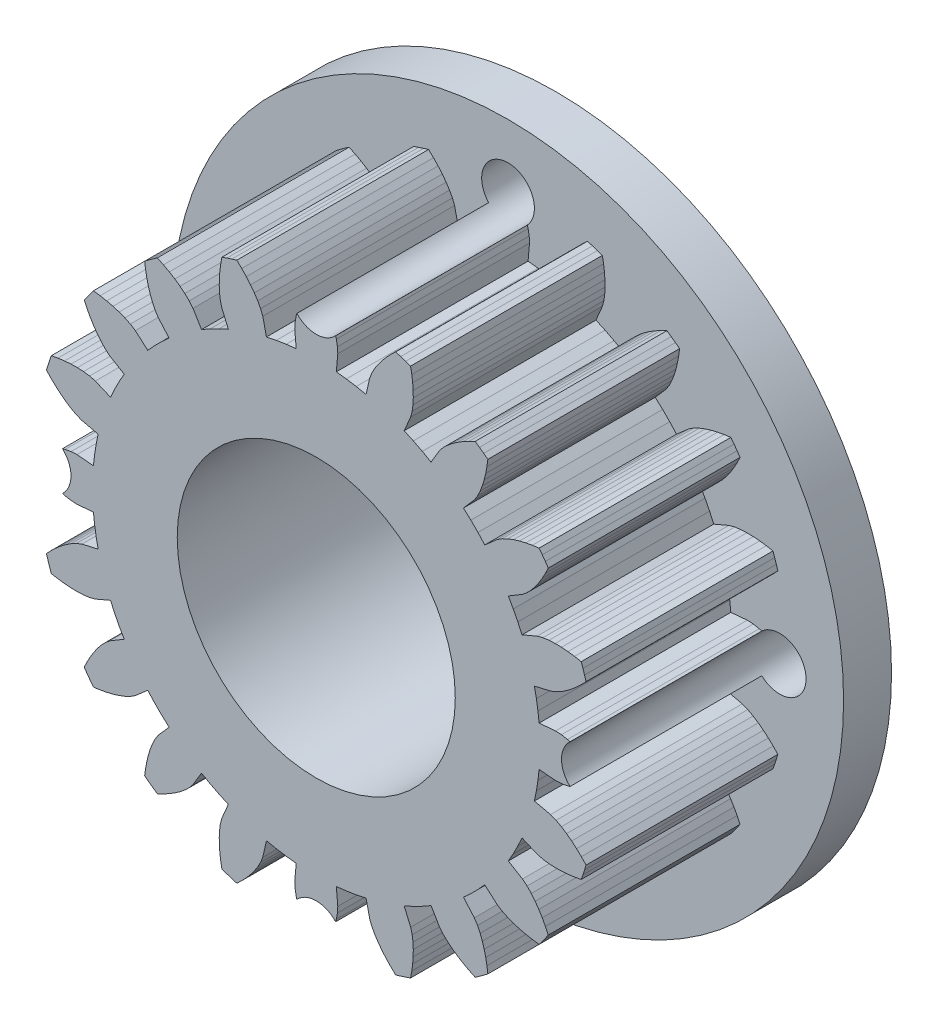
from build123d import *

# Parameters (mm, degrees)
SUN_TEETH_START     = 35
SKETCH_1_R          = 8.7
SUN_TEETH_DEPTH     = 12
SUN_FLANGE_START    = 32
SKETCH_2_R          = 21
SKETCH_2_R_2        = 8.7
SUN_FLANGE_DEPTH    = 3
SKETCH_3_R          = 1.65
THROUGH_HOLES_DEPTH = 100


with BuildPart() as part:
    # Эскиз1 → Sun_teeth (new body)
    with BuildSketch(Plane.XY.offset(SUN_TEETH_START)):
        Polygon((13.943722398, -1.25403576), (14.974643479, -1.346752171), (15.344385951, -1.325135863), (15.717782087, -1.256380008), (16.092947328, -1.1548734), (16.468861788, -1.025340024), (16.844697286, -0.870328211), (17.21970613, -0.691453831), (17.59318209, -0.489840726), (17.599242411, -0.163298986), (17.599242411, 0.163298986), (17.59318209, 0.489840726), (17.21970613, 0.691453831), (16.844697286, 0.870328211), (16.468861788, 1.025340024), (16.092947328, 1.1548734), (15.717782087, 1.256380008), (15.344385951, 1.325135863), (14.974643479, 1.346752171), (13.943722398, 1.25403576), (13.873337748, 1.878962405), (13.774959583, 2.500097694), (13.648786409, 3.116188305), (14.657901568, 3.346581891), (15.002867749, 3.48139693), (15.336741849, 3.662173385), (15.66217793, 3.874644342), (15.979665812, 4.11400186), (16.289205327, 4.37756641), (16.590584708, 4.663570161), (16.883479578, 4.970726036), (16.788336339, 5.283158428), (16.687412015, 5.593771558), (16.58074136, 5.902458466), (16.163242739, 5.978793504), (15.751312911, 6.033029043), (15.345970827, 6.064314481), (14.948426916, 6.071344086), (14.560256302, 6.051950172), (14.183888746, 6.001955124), (13.825562951, 5.908256748), (12.873749687, 5.501506067), (12.613696953, 6.074096572), (12.328192398, 6.634430811), (12.01781211, 7.181378146), (12.906342124, 7.712329201), (13.19276432, 7.947146335), (13.454434462, 8.222247732), (13.698285431, 8.524884899), (13.926268809, 8.850636577), (14.139212457, 9.196954331), (14.337461262, 9.562091412), (14.521104451, 9.944723502), (14.334070934, 10.212463486), (14.142101463, 10.476686796), (13.945262141, 10.737302446), (13.524608533, 10.680887212), (13.116080283, 10.605174957), (12.72090932, 10.509671585), (12.340650326, 10.393509312), (11.977471182, 10.255113287), (11.634973685, 10.0912612), (11.323139994, 9.891419989), (10.543604659, 9.210450629), (10.119339616, 9.674655846), (9.674655846, 10.119339616), (9.210450629, 10.543604659), (9.891419989, 11.323139994), (10.0912612, 11.634973685), (10.255113287, 11.977471182), (10.393509312, 12.340650326), (10.509671585, 12.72090932), (10.605174957, 13.116080283), (10.680887212, 13.524608533), (10.737302446, 13.945262141), (10.476686796, 14.142101463), (10.212463486, 14.334070934), (9.944723502, 14.521104451), (9.562091412, 14.337461262), (9.196954331, 14.139212457), (8.850636577, 13.926268809), (8.524884899, 13.698285431), (8.222247732, 13.454434462), (7.947146335, 13.19276432), (7.712329201, 12.906342124), (7.181378146, 12.01781211), (6.634430811, 12.328192398), (6.074096572, 12.613696953), (5.501506067, 12.873749687), (5.908256748, 13.825562951), (6.001955124, 14.183888746), (6.051950172, 14.560256302), (6.071344086, 14.948426916), (6.064314481, 15.345970827), (6.033029043, 15.751312911), (5.978793504, 16.163242739), (5.902458466, 16.58074136), (5.593771558, 16.687412015), (5.283158428, 16.788336339), (4.970726036, 16.883479578), (4.663570161, 16.590584708), (4.37756641, 16.289205327), (4.11400186, 15.979665812), (3.874644342, 15.66217793), (3.662173385, 15.336741849), (3.48139693, 15.002867749), (3.346581891, 14.657901568), (3.116188305, 13.648786409), (2.500097694, 13.774959583), (1.878962405, 13.873337748), (1.25403576, 13.943722398), (1.346752171, 14.974643479), (1.325135863, 15.344385951), (1.256380008, 15.717782087), (1.1548734, 16.092947328), (1.025340024, 16.468861788), (0.870328211, 16.844697286), (0.691453831, 17.21970613), (0.489840726, 17.59318209), (0.163298986, 17.599242411), (-0.163298986, 17.599242411), (-0.489840726, 17.59318209), (-0.691453831, 17.21970613), (-0.870328211, 16.844697286), (-1.025340024, 16.468861788), (-1.1548734, 16.092947328), (-1.256380008, 15.717782087), (-1.325135863, 15.344385951), (-1.346752171, 14.974643479), (-1.25403576, 13.943722398), (-1.878962405, 13.873337748), (-2.500097694, 13.774959583), (-3.116188305, 13.648786409), (-3.346581891, 14.657901568), (-3.48139693, 15.002867749), (-3.662173385, 15.336741849), (-3.874644342, 15.66217793), (-4.11400186, 15.979665812), (-4.37756641, 16.289205327), (-4.663570161, 16.590584708), (-4.970726036, 16.883479578), (-5.283158428, 16.788336339), (-5.593771558, 16.687412015), (-5.902458466, 16.58074136), (-5.978793504, 16.163242739), (-6.033029043, 15.751312911), (-6.064314481, 15.345970827), (-6.071344086, 14.948426916), (-6.051950172, 14.560256302), (-6.001955124, 14.183888746), (-5.908256748, 13.825562951), (-5.501506067, 12.873749687), (-6.074096572, 12.613696953), (-6.634430811, 12.328192398), (-7.181378146, 12.01781211), (-7.712329201, 12.906342124), (-7.947146335, 13.19276432), (-8.222247732, 13.454434462), (-8.524884899, 13.698285431), (-8.850636577, 13.926268809), (-9.196954331, 14.139212457), (-9.562091412, 14.337461262), (-9.944723502, 14.521104451), (-10.212463486, 14.334070934), (-10.476686796, 14.142101463), (-10.737302446, 13.945262141), (-10.680887212, 13.524608533), (-10.605174957, 13.116080283), (-10.509671585, 12.72090932), (-10.393509312, 12.340650326), (-10.255113287, 11.977471182), (-10.0912612, 11.634973685), (-9.891419989, 11.323139994), (-9.210450629, 10.543604659), (-9.674655846, 10.119339616), (-10.119339616, 9.674655846), (-10.543604659, 9.210450629), (-11.323139994, 9.891419989), (-11.634973685, 10.0912612), (-11.977471182, 10.255113287), (-12.340650326, 10.393509312), (-12.72090932, 10.509671585), (-13.116080283, 10.605174957), (-13.524608533, 10.680887212), (-13.945262141, 10.737302446), (-14.142101463, 10.476686796), (-14.334070934, 10.212463486), (-14.521104451, 9.944723502), (-14.337461262, 9.562091412), (-14.139212457, 9.196954331), (-13.926268809, 8.850636577), (-13.698285431, 8.524884899), (-13.454434462, 8.222247732), (-13.19276432, 7.947146335), (-12.906342124, 7.712329201), (-12.01781211, 7.181378146), (-12.328192398, 6.634430811), (-12.613696953, 6.074096572), (-12.873749687, 5.501506067), (-13.825562951, 5.908256748), (-14.183888746, 6.001955124), (-14.560256302, 6.051950172), (-14.948426916, 6.071344086), (-15.345970827, 6.064314481), (-15.751312911, 6.033029043), (-16.163242739, 5.978793504), (-16.58074136, 5.902458466), (-16.687412015, 5.593771558), (-16.788336339, 5.283158428), (-16.883479578, 4.970726036), (-16.590584708, 4.663570161), (-16.289205327, 4.37756641), (-15.979665812, 4.11400186), (-15.66217793, 3.874644342), (-15.336741849, 3.662173385), (-15.002867749, 3.48139693), (-14.657901568, 3.346581891), (-13.648786409, 3.116188305), (-13.774959583, 2.500097694), (-13.873337748, 1.878962405), (-13.943722398, 1.25403576), (-14.974643479, 1.346752171), (-15.344385951, 1.325135863), (-15.717782087, 1.256380008), (-16.092947328, 1.1548734), (-16.468861788, 1.025340024), (-16.844697286, 0.870328211), (-17.21970613, 0.691453831), (-17.59318209, 0.489840726), (-17.599242411, 0.163298986), (-17.599242411, -0.163298986), (-17.59318209, -0.489840726), (-17.21970613, -0.691453831), (-16.844697286, -0.870328211), (-16.468861788, -1.025340024), (-16.092947328, -1.1548734), (-15.717782087, -1.256380008), (-15.344385951, -1.325135863), (-14.974643479, -1.346752171), (-13.943722398, -1.25403576), (-13.873337748, -1.878962405), (-13.774959583, -2.500097694), (-13.648786409, -3.116188305), (-14.657901568, -3.346581891), (-15.002867749, -3.48139693), (-15.336741849, -3.662173385), (-15.66217793, -3.874644342), (-15.979665812, -4.11400186), (-16.289205327, -4.37756641), (-16.590584708, -4.663570161), (-16.883479578, -4.970726036), (-16.788336339, -5.283158428), (-16.687412015, -5.593771558), (-16.58074136, -5.902458466), (-16.163242739, -5.978793504), (-15.751312911, -6.033029043), (-15.345970827, -6.064314481), (-14.948426916, -6.071344086), (-14.560256302, -6.051950172), (-14.183888746, -6.001955124), (-13.825562951, -5.908256748), (-12.873749687, -5.501506067), (-12.613696953, -6.074096572), (-12.328192398, -6.634430811), (-12.01781211, -7.181378146), (-12.906342124, -7.712329201), (-13.19276432, -7.947146335), (-13.454434462, -8.222247732), (-13.698285431, -8.524884899), (-13.926268809, -8.850636577), (-14.139212457, -9.196954331), (-14.337461262, -9.562091412), (-14.521104451, -9.944723502), (-14.334070934, -10.212463486), (-14.142101463, -10.476686796), (-13.945262141, -10.737302446), (-13.524608533, -10.680887212), (-13.116080283, -10.605174957), (-12.72090932, -10.509671585), (-12.340650326, -10.393509312), (-11.977471182, -10.255113287), (-11.634973685, -10.0912612), (-11.323139994, -9.891419989), (-10.543604659, -9.210450629), (-10.119339616, -9.674655846), (-9.674655846, -10.119339616), (-9.210450629, -10.543604659), (-9.891419989, -11.323139994), (-10.0912612, -11.634973685), (-10.255113287, -11.977471182), (-10.393509312, -12.340650326), (-10.509671585, -12.72090932), (-10.605174957, -13.116080283), (-10.680887212, -13.524608533), (-10.737302446, -13.945262141), (-10.476686796, -14.142101463), (-10.212463486, -14.334070934), (-9.944723502, -14.521104451), (-9.562091412, -14.337461262), (-9.196954331, -14.139212457), (-8.850636577, -13.926268809), (-8.524884899, -13.698285431), (-8.222247732, -13.454434462), (-7.947146335, -13.19276432), (-7.712329201, -12.906342124), (-7.181378146, -12.01781211), (-6.634430811, -12.328192398), (-6.074096572, -12.613696953), (-5.501506067, -12.873749687), (-5.908256748, -13.825562951), (-6.001955124, -14.183888746), (-6.051950172, -14.560256302), (-6.071344086, -14.948426916), (-6.064314481, -15.345970827), (-6.033029043, -15.751312911), (-5.978793504, -16.163242739), (-5.902458466, -16.58074136), (-5.593771558, -16.687412015), (-5.283158428, -16.788336339), (-4.970726036, -16.883479578), (-4.663570161, -16.590584708), (-4.37756641, -16.289205327), (-4.11400186, -15.979665812), (-3.874644342, -15.66217793), (-3.662173385, -15.336741849), (-3.48139693, -15.002867749), (-3.346581891, -14.657901568), (-3.116188305, -13.648786409), (-2.500097694, -13.774959583), (-1.878962405, -13.873337748), (-1.25403576, -13.943722398), (-1.346752171, -14.974643479), (-1.325135863, -15.344385951), (-1.256380008, -15.717782087), (-1.1548734, -16.092947328), (-1.025340024, -16.468861788), (-0.870328211, -16.844697286), (-0.691453831, -17.21970613), (-0.489840726, -17.59318209), (-0.163298986, -17.599242411), (0.163298986, -17.599242411), (0.489840726, -17.59318209), (0.691453831, -17.21970613), (0.870328211, -16.844697286), (1.025340024, -16.468861788), (1.1548734, -16.092947328), (1.256380008, -15.717782087), (1.325135863, -15.344385951), (1.346752171, -14.974643479), (1.25403576, -13.943722398), (1.878962405, -13.873337748), (2.500097694, -13.774959583), (3.116188305, -13.648786409), (3.346581891, -14.657901568), (3.48139693, -15.002867749), (3.662173385, -15.336741849), (3.874644342, -15.66217793), (4.11400186, -15.979665812), (4.37756641, -16.289205327), (4.663570161, -16.590584708), (4.970726036, -16.883479578), (5.283158428, -16.788336339), (5.593771558, -16.687412015), (5.902458466, -16.58074136), (5.978793504, -16.163242739), (6.033029043, -15.751312911), (6.064314481, -15.345970827), (6.071344086, -14.948426916), (6.051950172, -14.560256302), (6.001955124, -14.183888746), (5.908256748, -13.825562951), (5.501506067, -12.873749687), (6.074096572, -12.613696953), (6.634430811, -12.328192398), (7.181378146, -12.01781211), (7.712329201, -12.906342124), (7.947146335, -13.19276432), (8.222247732, -13.454434462), (8.524884899, -13.698285431), (8.850636577, -13.926268809), (9.196954331, -14.139212457), (9.562091412, -14.337461262), (9.944723502, -14.521104451), (10.212463486, -14.334070934), (10.476686796, -14.142101463), (10.737302446, -13.945262141), (10.680887212, -13.524608533), (10.605174957, -13.116080283), (10.509671585, -12.72090932), (10.393509312, -12.340650326), (10.255113287, -11.977471182), (10.0912612, -11.634973685), (9.891419989, -11.323139994), (9.210450629, -10.543604659), (9.674655846, -10.119339616), (10.119339616, -9.674655846), (10.543604659, -9.210450629), (11.323139994, -9.891419989), (11.634973685, -10.0912612), (11.977471182, -10.255113287), (12.340650326, -10.393509312), (12.72090932, -10.509671585), (13.116080283, -10.605174957), (13.524608533, -10.680887212), (13.945262141, -10.737302446), (14.142101463, -10.476686796), (14.334070934, -10.212463486), (14.521104451, -9.944723502), (14.337461262, -9.562091412), (14.139212457, -9.196954331), (13.926268809, -8.850636577), (13.698285431, -8.524884899), (13.454434462, -8.222247732), (13.19276432, -7.947146335), (12.906342124, -7.712329201), (12.01781211, -7.181378146), (12.328192398, -6.634430811), (12.613696953, -6.074096572), (12.873749687, -5.501506067), (13.825562951, -5.908256748), (14.183888746, -6.001955124), (14.560256302, -6.051950172), (14.948426916, -6.071344086), (15.345970827, -6.064314481), (15.751312911, -6.033029043), (16.163242739, -5.978793504), (16.58074136, -5.902458466), (16.687412015, -5.593771558), (16.788336339, -5.283158428), (16.883479578, -4.970726036), (16.590584708, -4.663570161), (16.289205327, -4.37756641), (15.979665812, -4.11400186), (15.66217793, -3.874644342), (15.336741849, -3.662173385), (15.002867749, -3.48139693), (14.657901568, -3.346581891), (13.648786409, -3.116188305), (13.774959583, -2.500097694), (13.873337748, -1.878962405), align=None)
        Circle(SKETCH_1_R, mode=Mode.SUBTRACT)
    extrude(amount=SUN_TEETH_DEPTH)

    # Эскиз2 → Sun_flange (add)
    with BuildSketch(Plane.XY.offset(SUN_FLANGE_START)):
        Circle(SKETCH_2_R)
        Circle(SKETCH_2_R_2, mode=Mode.SUBTRACT)
    extrude(amount=SUN_FLANGE_DEPTH)

    # Эскиз3 → Through_holes (cut, symmetric)
    with BuildSketch(Plane.XY):
        with Locations((17, 0)):
            Circle(SKETCH_3_R)
        with Locations((0, 17)):
            Circle(SKETCH_3_R)
        with Locations((-17, 0)):
            Circle(SKETCH_3_R)
        with Locations((0, -17)):
            Circle(SKETCH_3_R)
    extrude(amount=THROUGH_HOLES_DEPTH, both=True, mode=Mode.SUBTRACT)


solid = part.part
